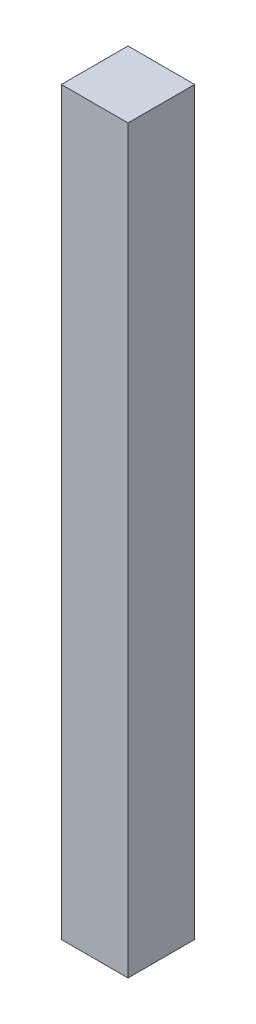
from build123d import *

# Parameters (mm, degrees)
TOPPING_KLAPE_KAT1_GAZLI_AMORTISOR_2_1_START = 8
SKETCH1_W                                    = 18
SKETCH1_H                                    = 200
TOPPING_KLAPE_KAT1_GAZLI_AMORTISOR_2_1_DEPTH = 18


with BuildPart() as part:
    # Sketch1 → TOPPING_klape_kat1_gazli_amortisor_2_1 (new body)
    with BuildSketch(Plane.XY.offset(TOPPING_KLAPE_KAT1_GAZLI_AMORTISOR_2_1_START)):
        with Locations((646, 1690)):
            Rectangle(SKETCH1_W, SKETCH1_H)
    extrude(amount=TOPPING_KLAPE_KAT1_GAZLI_AMORTISOR_2_1_DEPTH)


solid = part.part
